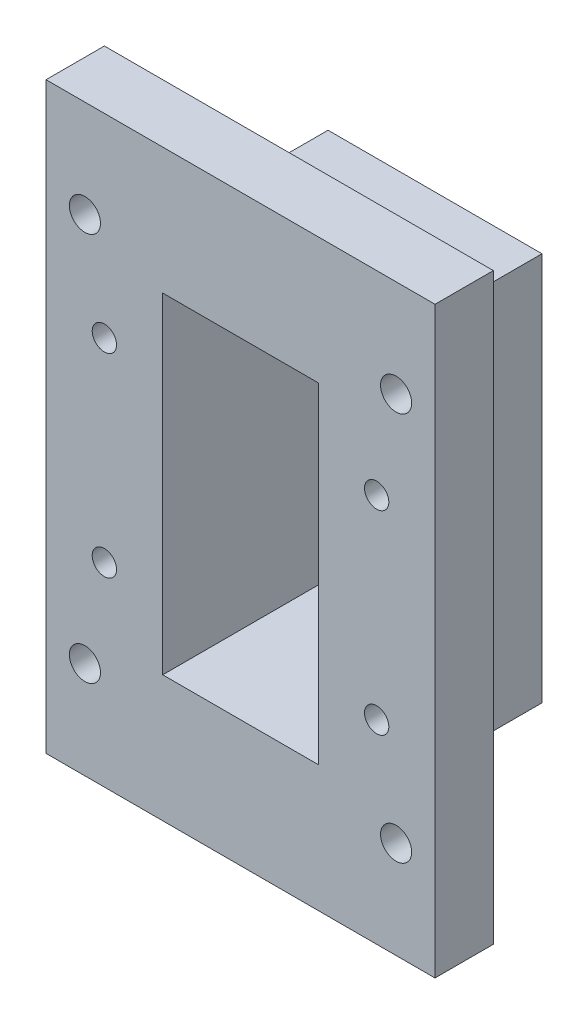
from build123d import *

# Parameters (mm, degrees)
SKETCH1_W               = 40
SKETCH1_H               = 60
BOSS_EXTRUDE1_DEPTH     = 6
M3_CLEARANCE_HOLE1_D    = 3.2
CUT_EXTRUDE1_DEPTH      = 73.360210061
CUT_EXTRUDE1_DEPTH_BACK = 73.360210061
SKETCH4_W               = 22
SKETCH4_H               = 40
SKETCH6_W               = 22
SKETCH6_H               = 40
SKETCH6_W_2             = 16
SKETCH6_H_2             = 34
BOSS_EXTRUDE2_DEPTH     = 20
TAP_DRILL_FOR_M3_TAP2_D = 2.5


with BuildPart() as part:
    # Sketch1 → Boss-Extrude1 (new body)
    with BuildSketch(Plane.XY):
        with Locations((20, 30)):
            Rectangle(SKETCH1_W, SKETCH1_H)
    extrude(amount=BOSS_EXTRUDE1_DEPTH)

    # M3 Clearance Hole1 (through all)
    with Locations(Plane.XY.offset(6)):
        with Locations((4, 10), (4, 50), (36, 50), (36, 10)):
            Hole(M3_CLEARANCE_HOLE1_D / 2)

    # Sketch4 → Cut-Extrude1 (cut, two sides: drawn at the far end of the back side and taken through both)
    with BuildSketch(Plane.XY.offset(6).offset(-CUT_EXTRUDE1_DEPTH_BACK)):
        with Locations((20, 30)):
            Rectangle(SKETCH4_W, SKETCH4_H)
    extrude(amount=CUT_EXTRUDE1_DEPTH + CUT_EXTRUDE1_DEPTH_BACK, mode=Mode.SUBTRACT)

    # Sketch6 → Boss-Extrude2 (add)
    with BuildSketch(Plane(origin=(0, 0, 6), x_dir=(-1, 0, 0), z_dir=(0, 0, -1))):
        with Locations((-20, 30)):
            Rectangle(SKETCH6_W, SKETCH6_H)
        with Locations((-20, 30)):
            Rectangle(SKETCH6_W_2, SKETCH6_H_2, mode=Mode.SUBTRACT)
    extrude(amount=BOSS_EXTRUDE2_DEPTH)

    # Tap Drill for M3 Tap2 (through all)
    with Locations(Plane.XY.offset(6)):
        with Locations((34, 40), (6, 40), (6, 20), (34, 20)):
            Hole(TAP_DRILL_FOR_M3_TAP2_D / 2)


solid = part.part
